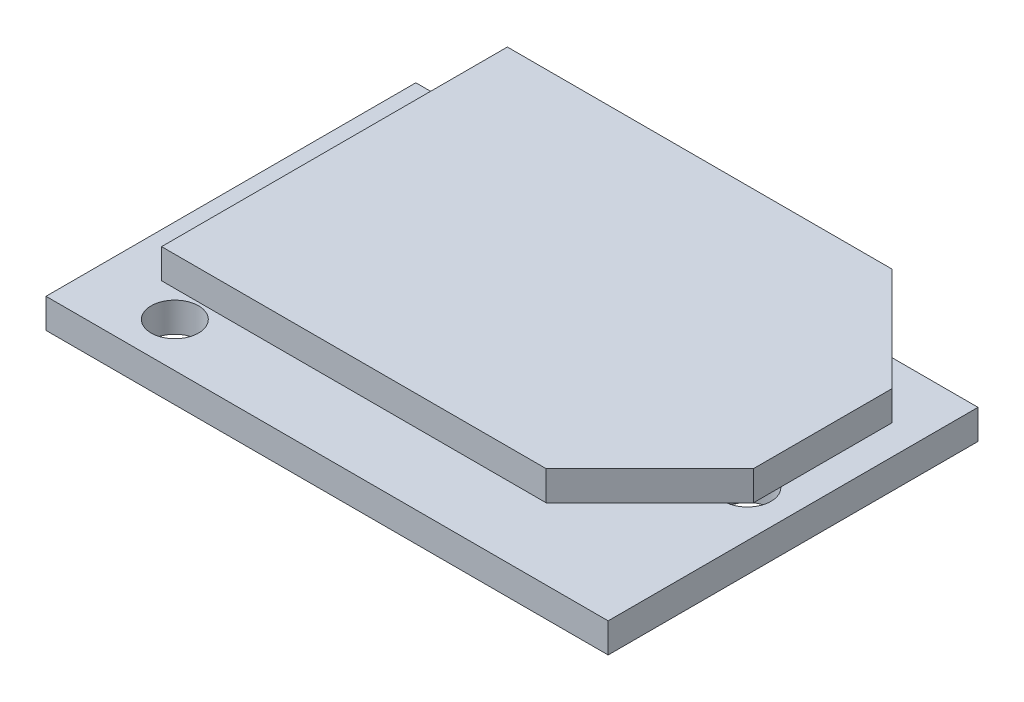
from build123d import *

# Parameters (mm, degrees)
SKETCH1_W           = 38
SKETCH1_H           = 25
SKETCH1_R           = 1.6
BOSS_EXTRUDE1_DEPTH = 2
BOSS_EXTRUDE2_START = 6
BOSS_EXTRUDE2_DEPTH = 2


with BuildPart() as part:
    # Sketch1 → Boss-Extrude1 (new body)
    with BuildSketch(Plane(origin=(0, 0, 0), x_dir=(1, 0, 0), z_dir=(0, 1, 0))):
        with Locations((19, 0)):
            Rectangle(SKETCH1_W, SKETCH1_H)
        with Locations(Location((5.71, 9.5, 0), (0, 0, 270))):
            Circle(SKETCH1_R, mode=Mode.SUBTRACT)
        with Locations(Location((5.71, -9.5, 0), (0, 0, 90))):
            Circle(SKETCH1_R, mode=Mode.SUBTRACT)
        with Locations(Location((34.91, 0, 0), (0, 0, 270))):
            Circle(SKETCH1_R, mode=Mode.SUBTRACT)
    extrude(amount=BOSS_EXTRUDE1_DEPTH)


with BuildPart() as body_2:
    # Sketch2 → Boss-Extrude2 (new body)
    with BuildSketch(Plane(origin=(0, 0, 0), x_dir=(1, 0, 0), z_dir=(0, 1, 0)).offset(BOSS_EXTRUDE2_START)):
        Polygon((33, -11.686418873), (40, -4.686418873), (40, 4.686418873), (33, 11.686418873), (7, 11.686418873), (7, -11.686418873), align=None)
    extrude(amount=BOSS_EXTRUDE2_DEPTH)


solid = Compound([part.part, body_2.part])
